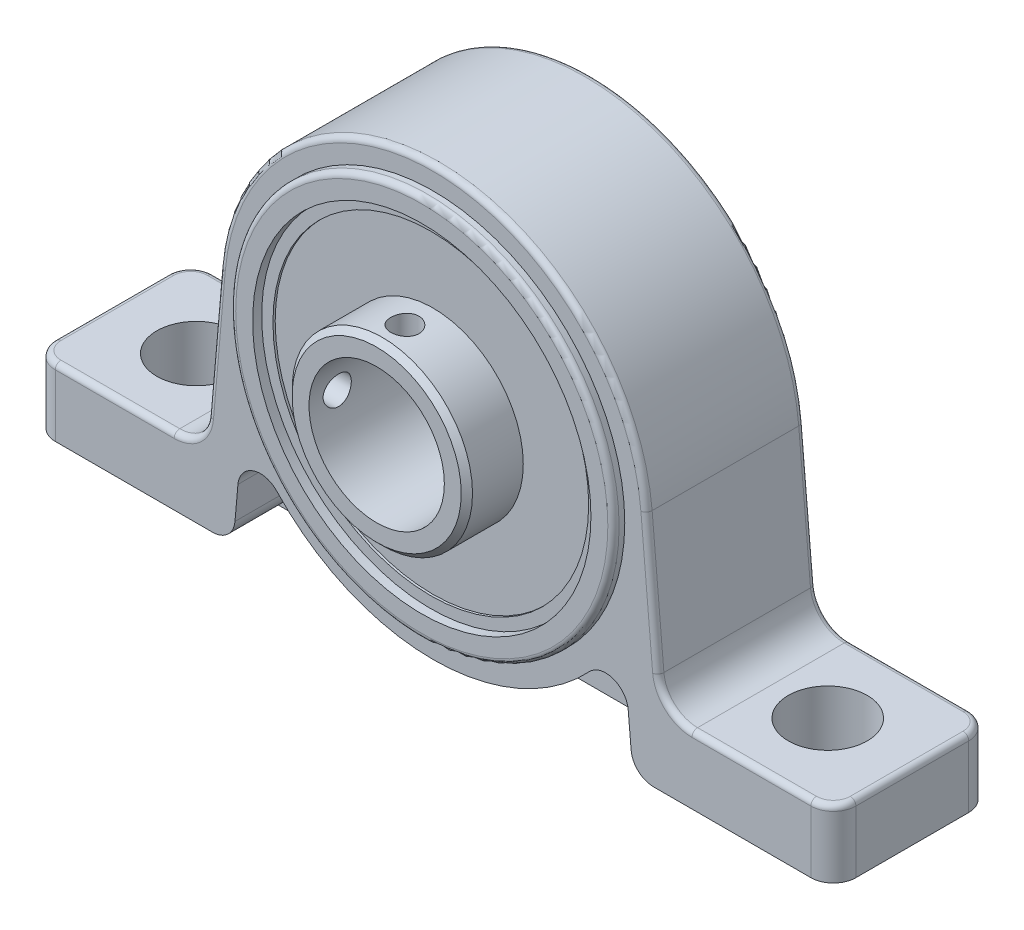
from build123d import *

# Parameters (mm, degrees)
SKETCH1_R           = 17
EXTRUDE_B_DEPTH     = 14
B1S_START           = 3
SKETCH1_3_R         = 17
SKETCH1_3_R_2       = 15
B1S_DEPTH           = 12
BOSS_EXTRUDE3_START = 3.2
SKETCH1_4_R         = 15
SKETCH1_4_R_2       = 14
BOSS_EXTRUDE3_DEPTH = 11
BOSS_EXTRUDE4_START = 3.5
SKETCH1_6_R         = 14
SKETCH1_6_R_2       = 8
BOSS_EXTRUDE4_DEPTH = 10.5
EXTRUDE_START       = 3
SKETCH1_7_R         = 8
SKETCH1_7_R_2       = 6
EXTRUDE_A_DEPTH     = 16
SKETCH2_W           = 39.112128712
SKETCH2_H           = 5.5
BOSS_EXTRUDE6_DEPTH = 2
CUT_EXTRUDE1_REACH  = 57.365
SKETCH3_R           = 1.25
CIRPATTERN1_COUNT   = 2
CIRPATTERN1_ANGLE   = 90
FILLET1_R           = 2
FILLET2_R           = 0.5
FILLET3_R           = 1
CHAMFER1_SIZE       = 0.5
SKETCH4_R           = 3.5
CUT_EXTRUDE2_DEPTH  = 52.43199404


with BuildPart() as part:
    # Sketch1 → B (new body)
    with BuildSketch(Plane.XY):
        with BuildLine():
            Line((-35.5, 6), (-35.5, 0))
            Line((-35.5, 0), (-19.556064356, 0))
            ThreePointArc((-19.556064356, 0), (-18.20488394, 0.525445326), (-17.56367496, 1.825688515))
            Line((-17.56367496, 1.825688515), (-17.303318327, 4.801578438))
            ThreePointArc((-17.303318327, 4.801578438), (-15.965194608, 6.517223677), (-13.852745223, 5.996098671))
            ThreePointArc((-13.852745223, 5.996098671), (0, 0), (13.852745223, 5.996098671))
            ThreePointArc((13.852745223, 5.996098671), (15.965194608, 6.517223677), (17.303318327, 4.801578438))
            Line((17.303318327, 4.801578438), (17.56367496, 1.825688515))
            ThreePointArc((17.56367496, 1.825688515), (18.20488394, 0.525445326), (19.556064356, 0))
            Line((19.556064356, 0), (35.5, 0))
            Line((35.5, 0), (35.5, 6))
            Line((35.5, 6), (22.958923061, 6))
            ThreePointArc((22.958923061, 6), (20.932152438, 6.78816799), (19.970338967, 8.738532772))
            Line((19.970338967, 8.738532772), (18.927699264, 20.655959112))
            ThreePointArc((18.927699264, 20.655959112), (0, 38), (-18.927699264, 20.655959112))
            Line((-18.927699264, 20.655959112), (-19.970338967, 8.738532772))
            ThreePointArc((-19.970338967, 8.738532772), (-20.932152438, 6.78816799), (-22.958923061, 6))
            Line((-22.958923061, 6), (-35.5, 6))
        make_face()
        with Locations((0, 19)):
            Circle(SKETCH1_R, mode=Mode.SUBTRACT)
    extrude(amount=EXTRUDE_B_DEPTH)

    # Sketch1<3> → B1S (add)
    with BuildSketch(Plane.XY.offset(B1S_START)):
        with Locations((0, 19)):
            Circle(SKETCH1_3_R)
        with Locations((0, 19)):
            Circle(SKETCH1_3_R_2, mode=Mode.SUBTRACT)
    extrude(amount=B1S_DEPTH)

    # Sketch1<4> → Boss-Extrude3 (add)
    with BuildSketch(Plane.XY.offset(BOSS_EXTRUDE3_START)):
        with Locations((0, 19)):
            Circle(SKETCH1_4_R)
        with Locations((0, 19)):
            Circle(SKETCH1_4_R_2, mode=Mode.SUBTRACT)
    extrude(amount=BOSS_EXTRUDE3_DEPTH)

    # Sketch1<6> → Boss-Extrude4 (add)
    with BuildSketch(Plane.XY.offset(BOSS_EXTRUDE4_START)):
        with Locations((0, 19)):
            Circle(SKETCH1_6_R)
        with Locations((0, 19)):
            Circle(SKETCH1_6_R_2, mode=Mode.SUBTRACT)
    extrude(amount=BOSS_EXTRUDE4_DEPTH)

    # Sketch1<7> → A (add)
    with BuildSketch(Plane.XY.offset(EXTRUDE_START)):
        with Locations((0, 19)):
            Circle(SKETCH1_7_R)
        with Locations((0, 19)):
            Circle(SKETCH1_7_R_2, mode=Mode.SUBTRACT)
    extrude(amount=EXTRUDE_A_DEPTH)

    # Sketch2 → Boss-Extrude6 (add, symmetric)
    with BuildSketch(Plane.XY.offset(7)):
        with Locations((0, 2.75)):
            Rectangle(SKETCH2_W, SKETCH2_H)
    extrude(amount=BOSS_EXTRUDE6_DEPTH, both=True)

    # Sketch3 → Cut-Extrude1 (cut, up to next)
    with BuildSketch(Plane(origin=(0, 0, 0), x_dir=(0, 0, -1), z_dir=(1, 0, 0)), mode=Mode.PRIVATE) as cut_extrude1_sk1:
        with Locations((-16.5, 19)):
            Circle(SKETCH3_R)
    cut_extrude1_tool1 = extrude(cut_extrude1_sk1.sketch, amount=-CUT_EXTRUDE1_REACH, mode=Mode.PRIVATE) & part.part
    cut_extrude1 = cut_extrude1_tool1.solids().sort_by_distance((0, 19, 16.5))[0]
    add(cut_extrude1, mode=Mode.SUBTRACT)

    # CirPattern1: Cut-Extrude1 ×2 about axis
    cirpattern1_axis = Axis((0, 19, 19), (0, 0, -1))
    for i in range(1, CIRPATTERN1_COUNT):
        add(cut_extrude1.rotate(cirpattern1_axis, i * CIRPATTERN1_ANGLE / (CIRPATTERN1_COUNT - 1)), mode=Mode.SUBTRACT)

    # Fillet1
    fillet1_edges = [part.edges().sort_by_distance(p)[0] for p in [
        (-35.5, 3, 0),
        (-35.5, 3, 14),
        (35.5, 3, 0),
        (35.5, 3, 14),
    ]]
    fillet(fillet1_edges, radius=FILLET1_R)

    # Fillet2
    fillet2_edges = [part.edges().sort_by_distance(p)[0] for p in [
        (19.449019115, 14.697245942, 14),
        (20.932152438, 6.78816799, 14),
        (28.229461531, 6, 14),
        (34.914213562, 6, 13.414213562),
        (35.5, 6, 7),
        (34.914213562, 6, 0.585786438),
        (28.229461531, 6, 0),
        (20.932152438, 6.78816799, 0),
        (19.449019115, 14.697245942, 0),
        (0, 38, 0),
        (-19.449019115, 14.697245942, 0),
        (-20.932152438, 6.78816799, 0),
        (-28.229461531, 6, 0),
        (-34.914213562, 6, 0.585786438),
        (-35.5, 6, 7),
        (-34.914213562, 6, 13.414213562),
        (-28.229461531, 6, 14),
        (-20.932152438, 6.78816799, 14),
        (-19.449019115, 14.697245942, 14),
        (0, 38, 14),
        (-17, 19, 15),
    ]]
    fillet(fillet2_edges, radius=FILLET2_R)

    # Fillet3
    fillet3_edges = [part.edges().sort_by_distance(p)[0] for p in [
        (-17, 19, 0),
    ]]
    fillet(fillet3_edges, radius=FILLET3_R)

    # Chamfer1
    chamfer1_edges = [part.edges().sort_by_distance(p)[0] for p in [
        (-8, 19, 19),
    ]]
    chamfer(chamfer1_edges, length=CHAMFER1_SIZE)

    # Sketch4 → Cut-Extrude2 (cut, through all)
    with BuildSketch(Plane(origin=(0, 6, 0), x_dir=(1, 0, 0), z_dir=(0, 1, 0))):
        with Locations((28, -7)):
            Circle(SKETCH4_R)
        with Locations((-28, -7)):
            Circle(SKETCH4_R)
    extrude(amount=-CUT_EXTRUDE2_DEPTH, mode=Mode.SUBTRACT)


solid = part.part
